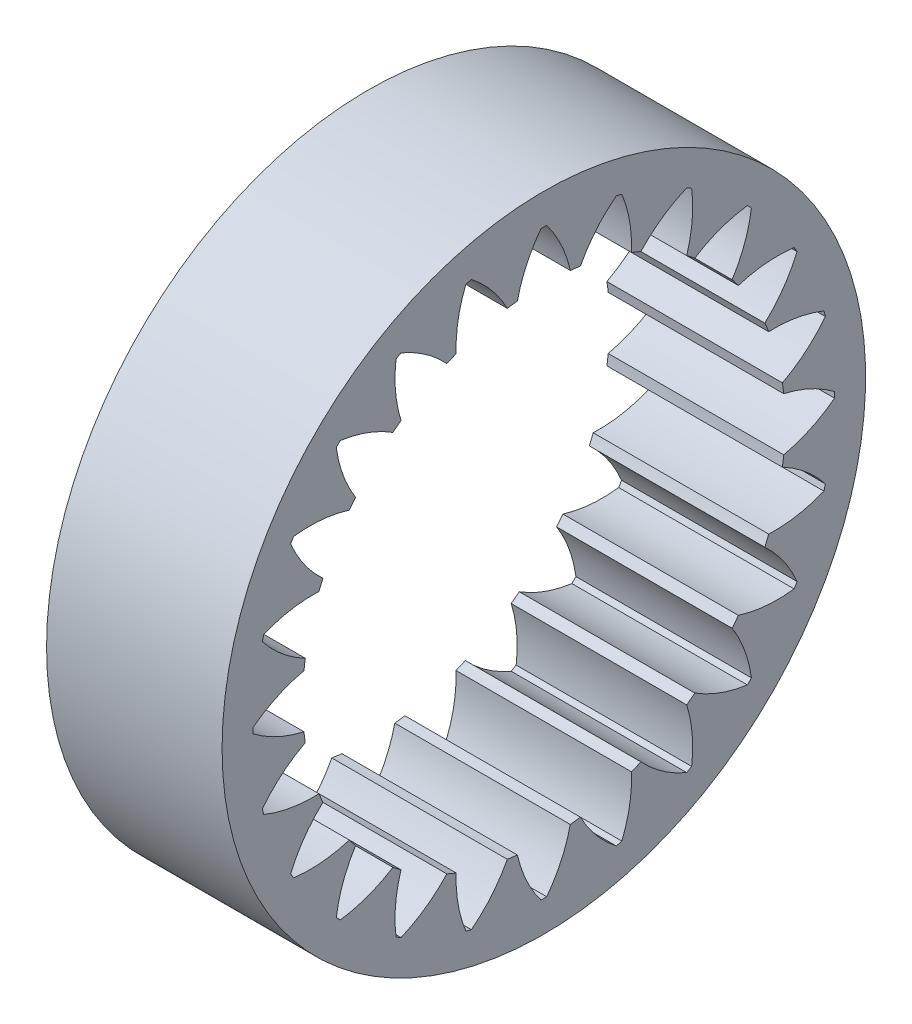
from build123d import *

# Parameters (mm, degrees)
BASPROSKE_W     = 12
BASPROSKE_H     = 5.5
TOOTHCUT_DEPTH  = 34.346664001
TEETHCUTS_COUNT = 24
TEETHCUTS_ANGLE = 345


with BuildPart() as part:
    # BasProSke → Base-Revolve (revolve)
    with BuildSketch(Plane(origin=(0, 0, 0), x_dir=(1, 0, 0), z_dir=(0, 1, 0)), mode=Mode.PRIVATE) as base_revolve_sk:
        with Locations((6, 19.25)):
            Rectangle(BASPROSKE_W, BASPROSKE_H)
    revolve(base_revolve_sk.sketch.rotate(Axis((-10, 0, 0), (1, 0, 0)), 180), axis=Axis((-10, 0, 0), (1, 0, 0)))

    # TooCutSke → ToothCut (cut, through all)
    with BuildSketch(Plane(origin=(0, 0, 0), x_dir=(0, 0, -1), z_dir=(1, 0, 0))):
        with BuildLine():
            ThreePointArc((1.813832515, 16.374445235), (1.194459065, 18.21243131), (0.195680074, 19.875036737))
            ThreePointArc((0.195680074, 19.875036737), (0, 19.876), (-0.195680074, 19.875036737))
            ThreePointArc((-0.195680074, 19.875036737), (-1.194459065, 18.21243131), (-1.813832515, 16.374445235))
            ThreePointArc((-1.813832515, 16.374445235), (0, 16.4746), (1.813832515, 16.374445235))
        make_face()
    toothcut = extrude(amount=TOOTHCUT_DEPTH, mode=Mode.SUBTRACT)

    # TeethCuts: ToothCut ×24 about axis
    teethcuts_axis = Axis((-10, 0, 0), (1, 0, 0))
    for i in range(1, TEETHCUTS_COUNT):
        add(toothcut.rotate(teethcuts_axis, i * TEETHCUTS_ANGLE / (TEETHCUTS_COUNT - 1)), mode=Mode.SUBTRACT)


solid = part.part
